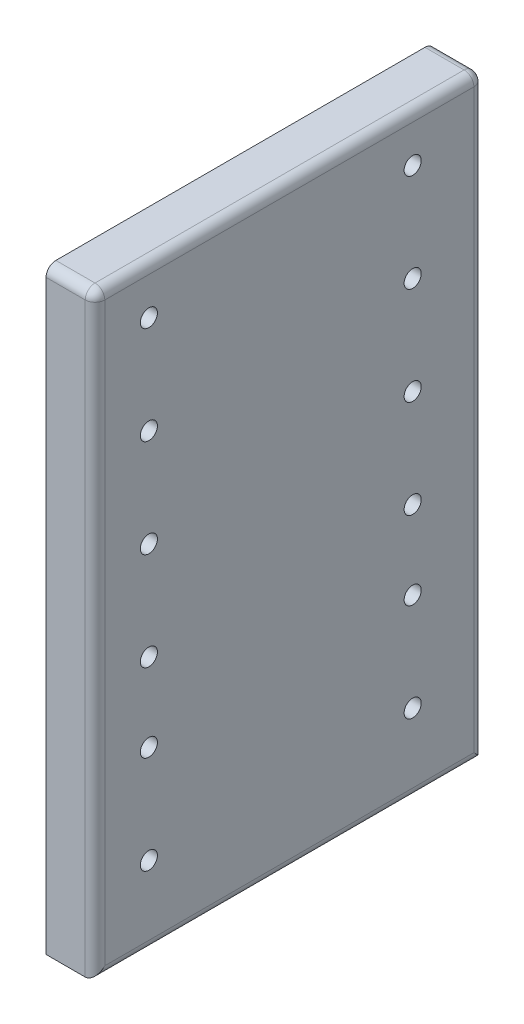
from build123d import *

# Parameters (mm, degrees)
SKETCH2_W           = 79.4
SKETCH2_H           = 121.8
BOSS_EXTRUDE1_DEPTH = 10
CUT_EXTRUDE1_DEPTH  = 3
SKETCH7_W           = 66.4
SKETCH7_H           = 111.011877984
CUT_EXTRUDE4_DEPTH  = 7.5
FILLET2_R           = 2
SKETCH6_R           = 1.75
CUT_EXTRUDE5_DEPTH  = 26.5


with BuildPart() as part:
    # Sketch2 → Boss-Extrude1 (new body)
    with BuildSketch(Plane(origin=(0, 0, 0), x_dir=(0, 0, -1), z_dir=(1, 0, 0))):
        with Locations((0, 39.742697631)):
            Rectangle(SKETCH2_W, SKETCH2_H)
    extrude(amount=BOSS_EXTRUDE1_DEPTH)

    # Sketch3 → Cut-Extrude1 (cut)
    with BuildSketch(Plane(origin=(0, 0, 0), x_dir=(0, 0, -1), z_dir=(1, 0, 0))):
        with BuildLine():
            Line((-38.7, 1.942697631), (-38.7, 2.940614447))
            Line((-38.7, 2.940614447), (-37.3, 2.940614447))
            Line((-37.3, 2.940614447), (-37.3, 98.342697631))
            ThreePointArc((-37.3, 98.342697631), (-36.919238816, 99.261936446), (-36, 99.642697631))
            Line((-36, 99.642697631), (36, 99.642697631))
            ThreePointArc((36, 99.642697631), (36.919238816, 99.261936446), (37.3, 98.342697631))
            Line((37.3, 98.342697631), (37.3, 2.940614447))
            Line((37.3, 2.940614447), (38.7, 2.940614447))
            Line((38.7, 2.940614447), (38.7, 1.942697631))
            Line((38.7, 1.942697631), (38.7, -20.157302369))
            Line((38.7, -20.157302369), (-38.7, -20.157302369))
            Line((-38.7, -20.157302369), (-38.7, 1.942697631))
        make_face()
        Polygon((-34.7, -15.857302369), (-34.7, -16.969180353), (34.7, -16.969180353), (34.7, -15.857302369), (34.7, -1.057302369), (34.7, -0.657302369), (34.7, 97.042697631), (-34.7, 97.042697631), (-34.7, -0.657302369), (-34.7, -1.057302369), align=None, mode=Mode.SUBTRACT)
    extrude(amount=CUT_EXTRUDE1_DEPTH, mode=Mode.SUBTRACT)

    # Sketch7 → Cut-Extrude4 (cut)
    with BuildSketch(Plane.ZY):
        with Locations((0, 40.036758639)):
            Rectangle(SKETCH7_W, SKETCH7_H)
    extrude(amount=-CUT_EXTRUDE4_DEPTH, mode=Mode.SUBTRACT)

    # Fillet2
    fillet2_edges = [part.edges().sort_by_distance(p)[0] for p in [
        (10, 39.742697631, -39.7),
        (10, 100.642697631, 0),
        (1.5, -16.969180353, 34.7),
        (1.5, -16.969180353, -34.7),
        (10, 39.742697631, 39.7),
        (7.5, -15.469180353, 0),
        (3.75, -15.469180353, 33.2),
        (7.5, 40.036758639, 33.2),
        (3.75, 95.542697631, 33.2),
        (7.5, 95.542697631, 0),
        (3.75, 95.542697631, -33.2),
        (7.5, 40.036758639, -33.2),
        (3.75, -15.469180353, -33.2),
        (10, -21.157302369, 0),
        (5, 100.642697631, 39.7),
        (5, 100.642697631, -39.7),
    ]]
    fillet(fillet2_edges, radius=FILLET2_R)

    # Sketch6 → Cut-Extrude5 (cut)
    with BuildSketch(Plane(origin=(10, 0, 0), x_dir=(0, 0, -1), z_dir=(1, 0, 0))):
        with Locations((-28.7, 91)):
            Circle(SKETCH6_R)
        with Locations((25.2, 91)):
            Circle(SKETCH6_R)
        with Locations((-28.7, 71)):
            Circle(SKETCH6_R)
        with Locations((-28.7, 51)):
            Circle(SKETCH6_R)
        with Locations((-28.7, 31)):
            Circle(SKETCH6_R)
        with Locations((25.2, 31)):
            Circle(SKETCH6_R)
        with Locations((25.2, 51)):
            Circle(SKETCH6_R)
        with Locations((25.2, 71)):
            Circle(SKETCH6_R)
        with Locations((-28.7, 15)):
            Circle(SKETCH6_R)
        with Locations((25.2, 15)):
            Circle(SKETCH6_R)
        with Locations((-28.7, -5)):
            Circle(SKETCH6_R)
        with Locations((25.2, -5)):
            Circle(SKETCH6_R)
    extrude(amount=-CUT_EXTRUDE5_DEPTH, mode=Mode.SUBTRACT)


solid = part.part
